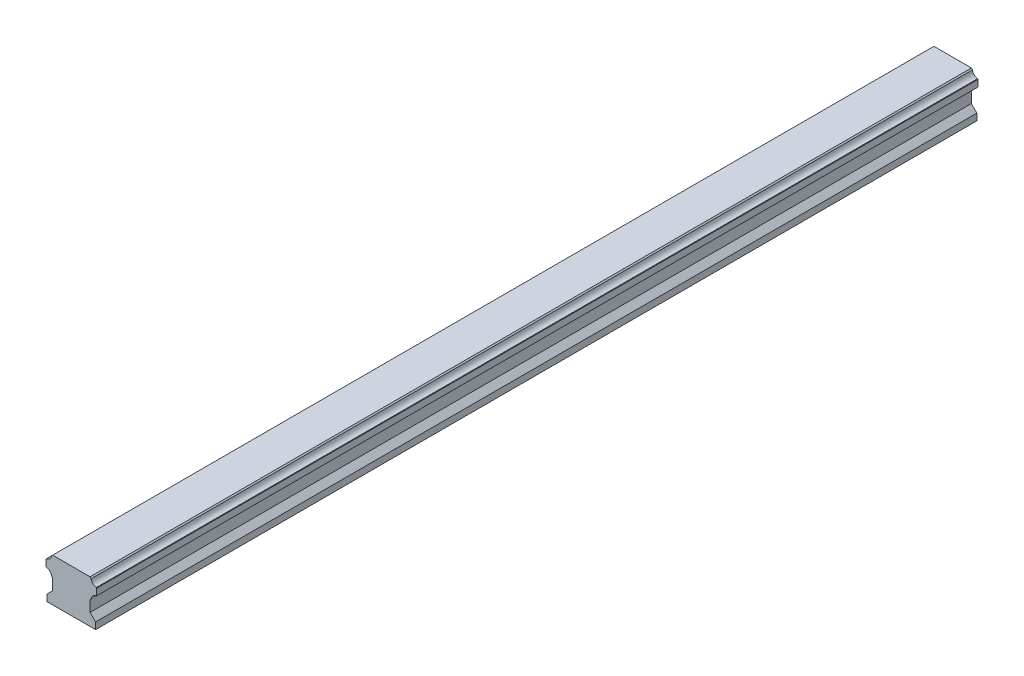
from build123d import *

# Parameters (mm, degrees)
ESTRUSIONE_ESTRUSIONE1_DEPTH = 400


with BuildPart() as part:
    # Schizzo1 → Estrusione-Estrusione1 (new body)
    with BuildSketch(Plane.XY):
        with BuildLine():
            Line((-10.001211602, -16.276222172), (-7.501211602, -13.776222172))
            Line((-7.501211602, -13.776222172), (-7.501211602, -8.776222172))
            Line((-7.501211602, -8.776222172), (-8.008796188, -8.268637585))
            ThreePointArc((-8.008796188, -8.268637585), (-8.733444649, -6.695460987), (-10.306621247, -5.970812526))
            Line((-10.306621247, -5.970812526), (-10.501211602, -5.776222172))
            Line((-10.501211602, -5.776222172), (-10.501211602, -2.776222172))
            Line((-10.501211602, -2.776222172), (-10.306621247, -2.581631817))
            ThreePointArc((-10.306621247, -2.581631817), (-8.733444649, -1.856983356), (-8.008796188, -0.283806758))
            Line((-8.008796188, -0.283806758), (-7.501211602, 0.223777828))
            Line((-7.501211602, 0.223777828), (9.498788398, 0.223777828))
            Line((9.498788398, 0.223777828), (10.006372984, -0.283806758))
            ThreePointArc((10.006372984, -0.283806758), (10.731021445, -1.856983356), (12.304198043, -2.581631817))
            Line((12.304198043, -2.581631817), (12.498788398, -2.776222172))
            Line((12.498788398, -2.776222172), (12.498788398, -5.776222172))
            Line((12.498788398, -5.776222172), (12.304198043, -5.970812526))
            ThreePointArc((12.304198043, -5.970812526), (10.731021445, -6.695460987), (10.006372984, -8.268637585))
            Line((10.006372984, -8.268637585), (9.498788398, -8.776222172))
            Line((9.498788398, -8.776222172), (9.498788398, -13.776222172))
            Line((9.498788398, -13.776222172), (11.998788398, -16.276222172))
            Line((11.998788398, -16.276222172), (11.998788398, -19.314402932))
            Line((11.998788398, -19.314402932), (-10.001211602, -19.314402932))
            Line((-10.001211602, -19.314402932), (-10.001211602, -16.276222172))
        make_face()
    extrude(amount=ESTRUSIONE_ESTRUSIONE1_DEPTH)


solid = part.part
